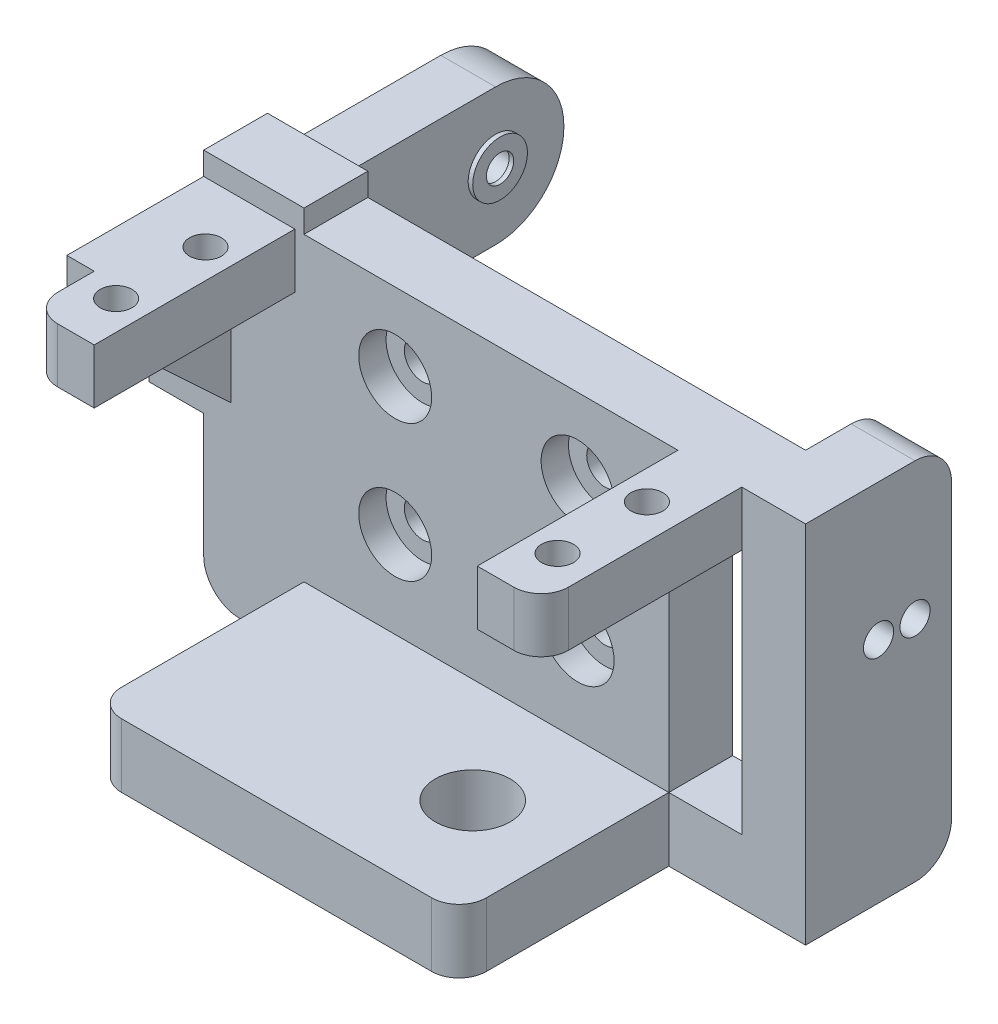
from build123d import *

# Parameters (mm, degrees)
EXTRUDE_START       = 24.2
SKETCH_4_R          = 1.75
EXTRUDE_1_DEPTH     = 6
SKETCH_5_W          = 40
SKETCH_5_H          = 34
SKETCH_5_R          = 2
EXTRUDE_2_DEPTH     = 7
CUT_EXTRUDE_START   = -21.5
SKETCH_6_R          = 4
CUT_EXTRUDE_1_DEPTH = 3
EXTRUDE_START_2     = -9.8
SKETCH_7_R          = 4.1
EXTRUDE_3_DEPTH     = 7
SKETCH_8_R          = 4.9
CUT_EXTRUDE_2_DEPTH = 0.9
EXTRUDE_START_3     = -53
SKETCH_9_R          = 1.65
EXTRUDE_4_DEPTH     = 6
EXTRUDE_START_4     = -21.5
EXTRUDE_5_DEPTH     = 7
EXTRUDE_START_5     = -28
EXTRUDE_7_DEPTH     = 3
EXTRUDE_START_6     = 28
SKETCH_14_R         = 1.65
EXTRUDE_8_DEPTH     = 7
SKETCH_15_W         = 8
SKETCH_15_H         = 7
EXTRUDE_9_DEPTH     = 7
SKETCH_17_R         = 3
SKETCH_17_R_2       = 1.5
EXTRUDE_11_DEPTH    = 0.5


with BuildPart() as part:
    # 草图4 → 凸台-拉伸1 (new body)
    with BuildSketch(Plane(origin=(0, 0, 0), x_dir=(1, 0, 0), z_dir=(0, 1, 0)).offset(EXTRUDE_START)):
        with BuildLine():
            Line((-28, 28.5), (28, 28.5))
            Line((28, 28.5), (28, 2.5))
            ThreePointArc((28, 2.5), (27.121320344, 0.378679656), (25, -0.5))
            Line((25, -0.5), (21, -0.5))
            Line((21, -0.5), (21, 21.5))
            Line((21, 21.5), (-21, 21.5))
            Line((-21, 21.5), (-21, -0.5))
            Line((-21, -0.5), (-25, -0.5))
            ThreePointArc((-25, -0.5), (-27.121320344, 0.378679656), (-28, 2.5))
            Line((-28, 2.5), (-28, 28.5))
        make_face()
        with Locations(Location((-24.2, 14.9, 0), (0, 0, 90))):
            Circle(SKETCH_4_R, mode=Mode.SUBTRACT)
        with Locations(Location((-24.2, 5.1, 0), (0, 0, 90))):
            Circle(SKETCH_4_R, mode=Mode.SUBTRACT)
        with Locations(Location((24.2, 14.9, 0), (0, 0, 90))):
            Circle(SKETCH_4_R, mode=Mode.SUBTRACT)
        with Locations(Location((24.2, 5.1, 0), (0, 0, 90))):
            Circle(SKETCH_4_R, mode=Mode.SUBTRACT)
    extrude(amount=EXTRUDE_1_DEPTH)

    # 草图5 → 凸台-拉伸2 (add)
    with BuildSketch(Plane(origin=(0, 0, -28.5), x_dir=(-1, 0, 0), z_dir=(0, 0, -1))):
        with Locations((0, 7.2)):
            Rectangle(SKETCH_5_W, SKETCH_5_H)
        with Locations((-10, 21.7)):
            Circle(SKETCH_5_R, mode=Mode.SUBTRACT)
        with Locations(Location((10, 21.7, 0), (0, 0, 180))):
            Circle(SKETCH_5_R, mode=Mode.SUBTRACT)
        with Locations((10, 6.7)):
            Circle(SKETCH_5_R, mode=Mode.SUBTRACT)
        with Locations(Location((-10, 6.7, 0), (0, 0, 180))):
            Circle(SKETCH_5_R, mode=Mode.SUBTRACT)
    extrude(amount=-EXTRUDE_2_DEPTH)

    # 草图6 → 切除-拉伸1 (cut)
    with BuildSketch(Plane.XY.offset(CUT_EXTRUDE_START)):
        with Locations((-10, 21.7)):
            Circle(SKETCH_6_R)
        with Locations((10, 21.7)):
            Circle(SKETCH_6_R)
        with Locations((-10, 6.7)):
            Circle(SKETCH_6_R)
        with Locations((10, 6.7)):
            Circle(SKETCH_6_R)
    extrude(amount=-CUT_EXTRUDE_1_DEPTH, mode=Mode.SUBTRACT)

    # 草图7 → 凸台-拉伸3 (add)
    with BuildSketch(Plane(origin=(0, 0, 0), x_dir=(1, 0, 0), z_dir=(0, 1, 0)).offset(EXTRUDE_START_2)):
        with BuildLine():
            Line((20, 21.5), (-20, 21.5))
            Line((-20, 21.5), (-20, 1.5))
            ThreePointArc((-20, 1.5), (-19.121320344, -0.621320344), (-17, -1.5))
            Line((-17, -1.5), (17, -1.5))
            ThreePointArc((17, -1.5), (19.121320344, -0.621320344), (20, 1.5))
            Line((20, 1.5), (20, 21.5))
        make_face()
        with Locations(Location((10, 10, 0), (0, 0, 90))):
            Circle(SKETCH_7_R, mode=Mode.SUBTRACT)
    extrude(amount=EXTRUDE_3_DEPTH)

    # 草图8 → 切除-拉伸2 (cut)
    with BuildSketch(Plane.XZ.offset(9.8)):
        with Locations(Location((10, -10, 0), (0, 0, 270))):
            Circle(SKETCH_8_R)
    extrude(amount=-CUT_EXTRUDE_2_DEPTH, mode=Mode.SUBTRACT)



with BuildPart() as body_2:
    # 草图9 → 凸台-拉伸4 (new body)
    with BuildSketch(Plane(origin=(22, 25.2, -45.868265324), x_dir=(0, 0, 1), z_dir=(1, 0, 0)).offset(EXTRUDE_START_3)):
        with BuildLine():
            Line((-7.631734676, 2.5), (24.368265324, 2.5))
            Line((24.368265324, 2.5), (24.368265324, 17.5))
            Line((24.368265324, 17.5), (-7.631734676, 17.5))
            ThreePointArc((-7.631734676, 17.5), (-15.131734676, 10), (-7.631734676, 2.5))
        make_face()
        with Locations(Location((-7.631734676, 10, 0), (0, 0, 180))):
            Circle(SKETCH_9_R, mode=Mode.SUBTRACT)
    extrude(amount=-EXTRUDE_4_DEPTH)


with BuildPart() as part_1:
    add(part.part)

    add(body_2.part)  # 凸台-拉伸5 merges body 2
    # 草图10 → 凸台-拉伸5 (add)
    with BuildSketch(Plane.XY.offset(EXTRUDE_START_4)):
        with BuildLine():
            Line((-31, 32.7), (-20, 32.7))
            Line((-20, 32.7), (-20, -9.8))
            Line((-20, -9.8), (-27, -9.8))
            ThreePointArc((-27, -9.8), (-29.828427125, -8.628427125), (-31, -5.8))
            Line((-31, -5.8), (-31, 32.7))
        make_face()
    extrude(amount=-EXTRUDE_5_DEPTH)

    # 草图12 → 凸台-拉伸7 (add)
    with BuildSketch(Plane(origin=(0, 0, 0), x_dir=(0, 0, -1), z_dir=(1, 0, 0)).offset(EXTRUDE_START_5)):
        Polygon((6.5, 30.2), (6.5, 24.2), (21.5, 10.2), (21.5, 30.2), align=None)
    extrude(amount=-EXTRUDE_7_DEPTH)

    # 草图14 → 凸台-拉伸8 (add)
    with BuildSketch(Plane(origin=(0, 0, 0), x_dir=(0, 0, -1), z_dir=(1, 0, 0)).offset(EXTRUDE_START_6)):
        with BuildLine():
            Line((21.5, 30.2), (33.5, 30.2))
            ThreePointArc((33.5, 30.2), (36.328427125, 29.028427125), (37.5, 26.2))
            Line((37.5, 26.2), (37.5, -5.8))
            ThreePointArc((37.5, -5.8), (36.328427125, -8.628427125), (33.5, -9.8))
            Line((33.5, -9.8), (21.5, -9.8))
            Line((21.5, -9.8), (21.5, 30.2))
        make_face()
        with Locations((29.5, 15.2)):
            Circle(SKETCH_14_R, mode=Mode.SUBTRACT)
        with Locations((33.5, 15.2)):
            Circle(SKETCH_14_R, mode=Mode.SUBTRACT)
    extrude(amount=EXTRUDE_8_DEPTH)

    # 草图15 → 凸台-拉伸9 (add)
    with BuildSketch(Plane(origin=(0, 0, 0), x_dir=(1, 0, 0), z_dir=(0, 1, 0)).offset(EXTRUDE_START_2)):
        with Locations((24, 25)):
            Rectangle(SKETCH_15_W, SKETCH_15_H)
    extrude(amount=EXTRUDE_9_DEPTH)

    # 草图17 → 凸台-拉伸11 (add)
    with BuildSketch(Plane(origin=(-31, 0, 0), x_dir=(0, 0, -1), z_dir=(1, 0, 0))):
        with Locations(Location((53.5, 15.2, 0), (0, 0, 90))):
            Circle(SKETCH_17_R)
        with Locations(Location((53.5, 15.2, 0), (0, 0, 90))):
            Circle(SKETCH_17_R_2, mode=Mode.SUBTRACT)
    extrude(amount=EXTRUDE_11_DEPTH)


solid = part_1.part
